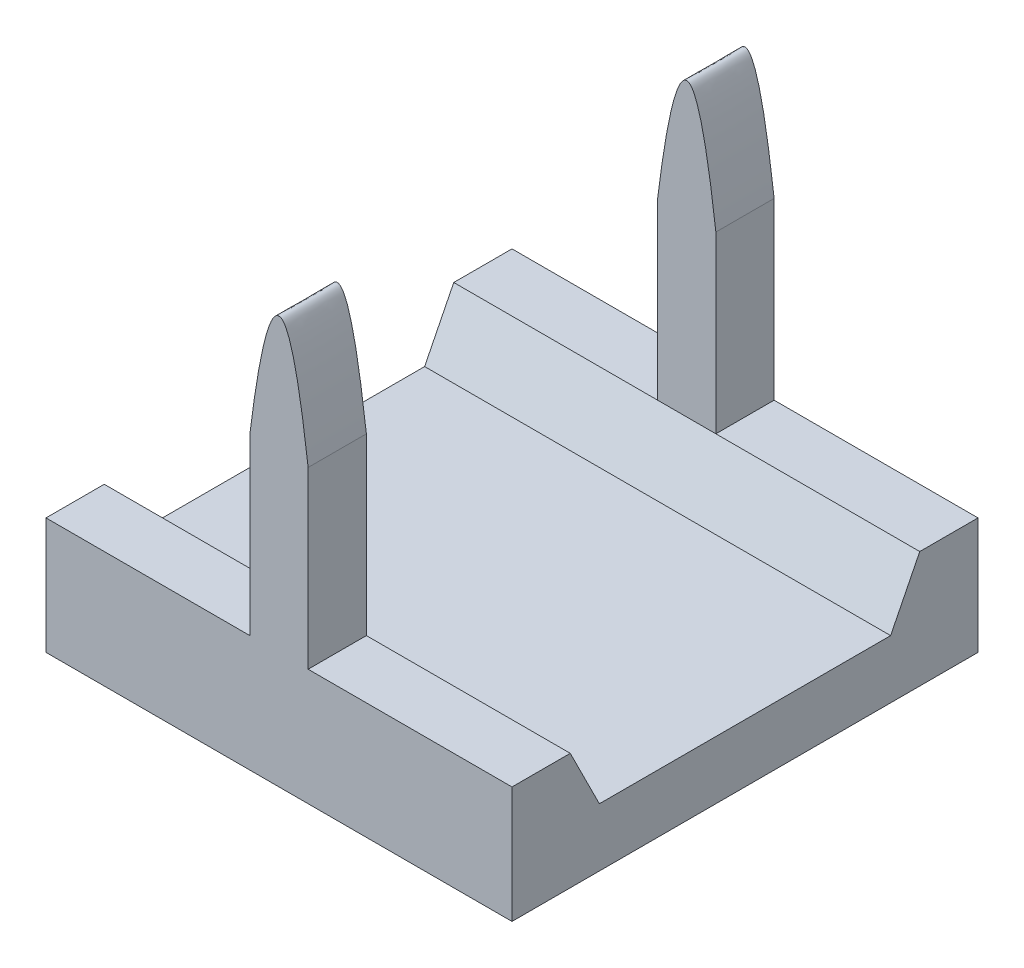
from build123d import *

# Parameters (mm, degrees)
SKETCH2_W               = 80
SKETCH2_H               = 80
BOSS_EXTRUDE1_DEPTH     = 20
BOSS_EXTRUDE2_DEPTH     = 10
CUT_EXTRUDE1_DEPTH      = 134.041347129
CUT_EXTRUDE1_DEPTH_BACK = 134.041347129


with BuildPart() as part:
    # Sketch2 → Boss-Extrude1 (new body)
    with BuildSketch(Plane(origin=(0, 0, 0), x_dir=(1, 0, 0), z_dir=(0, 1, 0))):
        with Locations((40, 40)):
            Rectangle(SKETCH2_W, SKETCH2_H)
    extrude(amount=BOSS_EXTRUDE1_DEPTH)

    # Sketch3 → Boss-Extrude2 (add)
    with BuildSketch(Plane.XY):
        with BuildLine():
            Line((35, 20), (35, 50))
            add(Edge.make_bspline(
                [(35, 50), (40, 90), (45, 50)],
                knots=[0, 0, 0, 1, 1, 1], degree=2))
            Line((45, 50), (45, 20))
            Line((45, 20), (35, 20))
        make_face()
    boss_extrude2 = extrude(amount=-BOSS_EXTRUDE2_DEPTH)

    # Mirror1: Boss-Extrude2 across plane
    add(boss_extrude2.mirror(Plane.XY.offset(-40)))

    # Sketch4 → Cut-Extrude1 (cut, two sides: drawn at the far end of the back side and taken through both)
    with BuildSketch(Plane(origin=(80, 0, 0), x_dir=(0, 0, -1), z_dir=(1, 0, 0)).offset(-CUT_EXTRUDE1_DEPTH_BACK)):
        Polygon((70, 20), (10, 20), (15, 10), (65, 10), align=None)
    extrude(amount=CUT_EXTRUDE1_DEPTH + CUT_EXTRUDE1_DEPTH_BACK, mode=Mode.SUBTRACT)


solid = part.part
